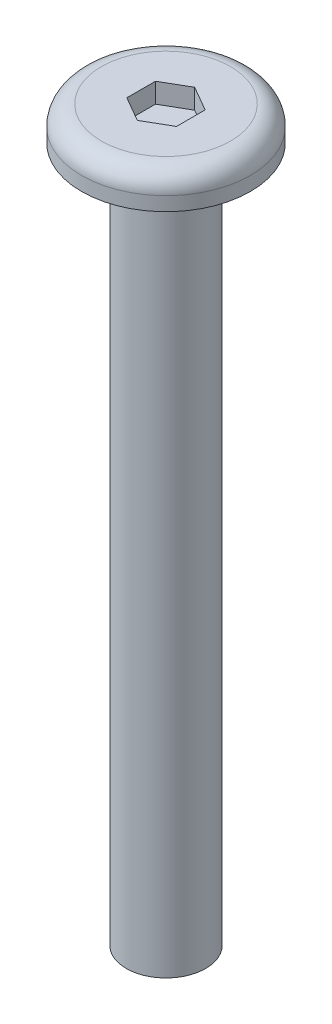
from build123d import *

# Parameters (mm, degrees)
SKETCH_1_R          = 2
SKETCH_1_R_2        = 1.5
EXTRUDE_1_DEPTH     = 35
SKETCH_2_R          = 4.25
EXTRUDE_2_DEPTH     = 1.7
CUT_EXTRUDE_1_DEPTH = 1
FILLET_1_R          = 1


with BuildPart() as part:
    # 草图1 → 凸台-拉伸1 (new body)
    with BuildSketch(Plane(origin=(0, 0, 0), x_dir=(1, 0, 0), z_dir=(0, 1, 0))):
        with Locations(Location((0, 0, 0), (0, 0, 270))):
            Circle(SKETCH_1_R)
        with Locations(Location((0, 0, 0), (0, 0, 270))):
            Circle(SKETCH_1_R_2, mode=Mode.SUBTRACT)
    extrude(amount=EXTRUDE_1_DEPTH)

    # 草图2 → 凸台-拉伸2 (add)
    with BuildSketch(Plane(origin=(0, 35, 0), x_dir=(1, 0, 0), z_dir=(0, 1, 0))):
        with Locations(Location((0, 0, 0), (0, 0, 270))):
            Circle(SKETCH_2_R)
    extrude(amount=EXTRUDE_2_DEPTH)

    # 草图3 → 切除-拉伸1 (cut)
    with BuildSketch(Plane(origin=(0, 36.7, 0), x_dir=(1, 0, 0), z_dir=(0, 1, 0))):
        Polygon((1.25, 0.721687836), (0, 1.443375673), (-1.25, 0.721687836), (-1.25, -0.721687836), (0, -1.443375673), (1.25, -0.721687836), align=None)
    extrude(amount=-CUT_EXTRUDE_1_DEPTH, mode=Mode.SUBTRACT)

    # 圆角1
    fillet_1_edges = [part.edges().sort_by_distance(p)[0] for p in [
        (0, 36.7, -4.25),
    ]]
    fillet(fillet_1_edges, radius=FILLET_1_R)


solid = part.part
